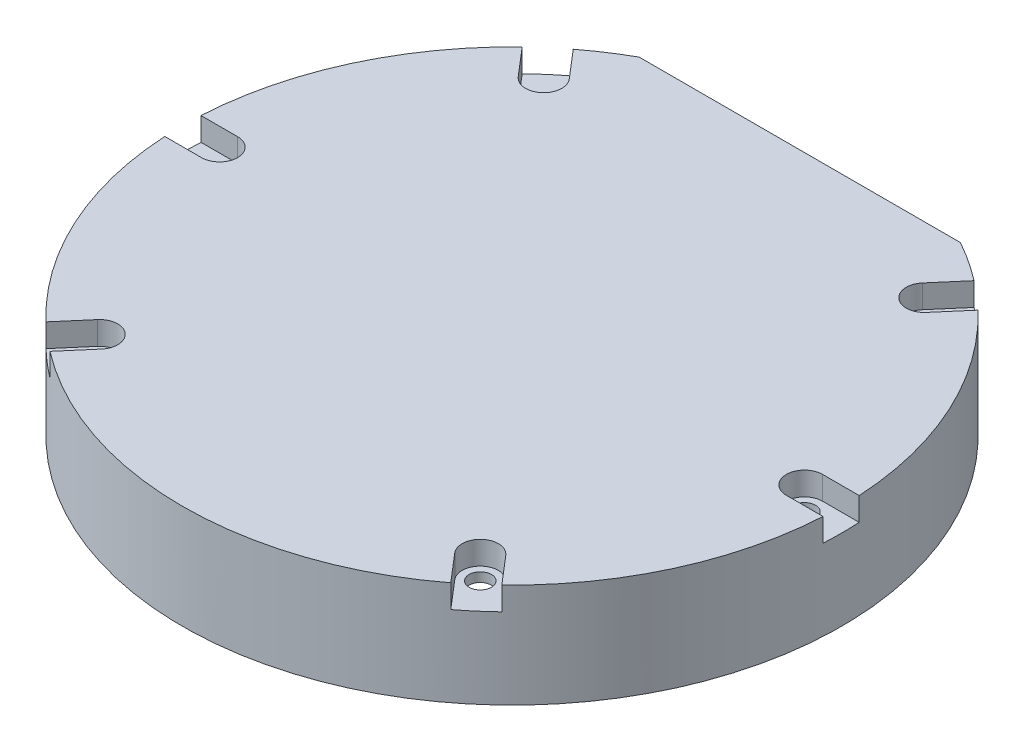
from build123d import *

# Parameters (mm, degrees)
SKETCH1_R            = 35.5
BOSS_EXTRUDE1_DEPTH  = 2
SKETCH2_R            = 35.5
SKETCH2_R_2          = 34
BOSS_EXTRUDE2_DEPTH  = 9.2
SKETCH5_R            = 34
SKETCH5_R_2          = 28.75
BOSS_EXTRUDE3_DEPTH  = 1.5
CUT_EXTRUDE2_REACH   = 53.439
CUT_EXTRUDE3_REACH   = 53.041
M2_CLEARANCE_HOLE1_D = 2.4
SKETCH10_R           = 1.2
CUT_EXTRUDE4_DEPTH   = 2.5


with BuildPart() as part:
    # Sketch1 → Boss-Extrude1 (new body)
    with BuildSketch(Plane.XZ):
        with Locations(Location((0, 0, 0), (0, 0, 270))):
            Circle(SKETCH1_R)
    extrude(amount=BOSS_EXTRUDE1_DEPTH)

    # Sketch2 → Boss-Extrude2 (add)
    with BuildSketch(Plane.XZ.offset(2)):
        with Locations(Location((0, 0, 0), (0, 0, 270))):
            Circle(SKETCH2_R)
        with Locations(Location((0, 0, 0), (0, 0, 270))):
            Circle(SKETCH2_R_2, mode=Mode.SUBTRACT)
    extrude(amount=BOSS_EXTRUDE2_DEPTH)

    # Sketch5 → Boss-Extrude3 (add)
    with BuildSketch(Plane.XZ.offset(2)):
        with Locations(Location((0, 0, 0), (0, 0, 270))):
            Circle(SKETCH5_R)
        with Locations(Location((0, 0, 0), (0, 0, 270))):
            Circle(SKETCH5_R_2, mode=Mode.SUBTRACT)
    extrude(amount=BOSS_EXTRUDE3_DEPTH)

    # Sketch3 → Cut-Extrude2 (cut, up to next)
    with BuildSketch(Plane(origin=(0, 0, 0), x_dir=(1, 0, 0), z_dir=(0, 1, 0)), mode=Mode.PRIVATE) as cut_extrude2_sk1:
        with BuildLine():
            Line((-17.298843892, 31), (17.298843892, 31))
            ThreePointArc((17.298843892, 31), (0, 35.5), (-17.298843892, 31))
        make_face()
    cut_extrude2_tool1 = extrude(cut_extrude2_sk1.sketch, amount=-CUT_EXTRUDE2_REACH, mode=Mode.PRIVATE) & part.part
    add(cut_extrude2_tool1.solids().sort_by_distance((0, 0, -32.810151))[0], mode=Mode.SUBTRACT)

    # Sketch6 → Cut-Extrude3 (cut, up to next)
    with BuildSketch(Plane.XZ.offset(2), mode=Mode.PRIVATE) as cut_extrude3_sk1:
        Polygon((-18.869547058, -31), (-16, -23.886450134), (16, -23.886450134), (18.869547058, -31), align=None)
    cut_extrude3_tool1 = extrude(cut_extrude3_sk1.sketch, amount=CUT_EXTRUDE3_REACH, mode=Mode.PRIVATE) & part.part
    add(cut_extrude3_tool1.solids().sort_by_distance((0, -2, -27.540792))[0], mode=Mode.SUBTRACT)

    # M2 Clearance Hole1 (through all)
    with Locations(Plane(origin=(0, 0, 0), x_dir=(1, 0, 0), z_dir=(0, 1, 0))):
        with Locations((-20.5, 23.916521486), (-31.5, 0), (-20.5, -23.916521486), (31.5, 0), (20.5, 23.916521486), (20.5, -23.916521486)):
            Hole(M2_CLEARANCE_HOLE1_D / 2)

    # Sketch10 → Cut-Extrude4 (cut)
    # profile 1 of 6: a face of its own
    with BuildSketch(Plane(origin=(0, 0, 0), x_dir=(1, 0, 0), z_dir=(0, 1, 0))):
        with BuildLine():
            Line((-35.446403203, 1.95), (-31.5, 1.95))
            ThreePointArc((-31.5, 1.95), (-29.55, 0), (-31.5, -1.95))
            Line((-31.5, -1.95), (-35.446403203, -1.95))
            ThreePointArc((-35.446403203, -1.95), (-35.5, 0), (-35.446403203, 1.95))
        make_face()
        with Locations(Location((-31.5, 0, 0), (0, 0, 270))):
            Circle(SKETCH10_R, mode=Mode.SUBTRACT)
    # profile 2 of 6: a face of its own
    with BuildSketch(Plane(origin=(0, 0, 0), x_dir=(1, 0, 0), z_dir=(0, 1, 0))):
        with BuildLine():
            Line((-24.548840716, 25.643798851), (-21.980546568, 22.647473867))
            ThreePointArc((-21.980546568, 22.647473867), (-19.230952381, 22.435974918), (-19.019453432, 25.185569105))
            Line((-19.019453432, 25.185569105), (-21.58774758, 28.181894089))
            ThreePointArc((-21.58774758, 28.181894089), (-23.103174603, 26.953540088), (-24.548840716, 25.643798851))
        make_face()
        with Locations(Location((-20.5, 23.916521486, 0), (0, 0, 270))):
            Circle(SKETCH10_R, mode=Mode.SUBTRACT)
    # profile 3 of 6: a face of its own
    with BuildSketch(Plane(origin=(0, 0, 0), x_dir=(1, 0, 0), z_dir=(0, 1, 0))):
        with BuildLine():
            Line((-21.58774758, -28.181894089), (-19.019453432, -25.185569105))
            ThreePointArc((-19.019453432, -25.185569105), (-19.230952381, -22.435974918), (-21.980546568, -22.647473867))
            Line((-21.980546568, -22.647473867), (-24.548840716, -25.643798851))
            ThreePointArc((-24.548840716, -25.643798851), (-23.103174603, -26.953540088), (-21.58774758, -28.181894089))
        make_face()
        with Locations(Location((-20.5, -23.916521486, 0), (0, 0, 270))):
            Circle(SKETCH10_R, mode=Mode.SUBTRACT)
    # profile 4 of 6: a face of its own
    with BuildSketch(Plane(origin=(0, 0, 0), x_dir=(1, 0, 0), z_dir=(0, 1, 0))):
        with BuildLine():
            Line((24.548840716, -25.643798851), (21.980546568, -22.647473867))
            ThreePointArc((21.980546568, -22.647473867), (19.230952381, -22.435974918), (19.019453432, -25.185569105))
            Line((19.019453432, -25.185569105), (21.58774758, -28.181894089))
            ThreePointArc((21.58774758, -28.181894089), (23.103174603, -26.953540088), (24.548840716, -25.643798851))
        make_face()
        with Locations(Location((20.5, -23.916521486, 0), (0, 0, 90))):
            Circle(SKETCH10_R, mode=Mode.SUBTRACT)
    # profile 5 of 6: a face of its own
    with BuildSketch(Plane(origin=(0, 0, 0), x_dir=(1, 0, 0), z_dir=(0, 1, 0))):
        with BuildLine():
            Line((21.58774758, 28.181894089), (19.019453432, 25.185569105))
            ThreePointArc((19.019453432, 25.185569105), (19.230952381, 22.435974918), (21.980546568, 22.647473867))
            Line((21.980546568, 22.647473867), (24.548840716, 25.643798851))
            ThreePointArc((24.548840716, 25.643798851), (23.103174603, 26.953540088), (21.58774758, 28.181894089))
        make_face()
        with Locations(Location((20.5, 23.916521486, 0), (0, 0, 90))):
            Circle(SKETCH10_R, mode=Mode.SUBTRACT)
    # profile 6 of 6: a face of its own
    with BuildSketch(Plane(origin=(0, 0, 0), x_dir=(1, 0, 0), z_dir=(0, 1, 0))):
        with BuildLine():
            Line((35.446403203, -1.95), (31.5, -1.95))
            ThreePointArc((31.5, -1.95), (29.55, 0), (31.5, 1.95))
            Line((31.5, 1.95), (35.446403203, 1.95))
            ThreePointArc((35.446403203, 1.95), (35.5, 0), (35.446403203, -1.95))
        make_face()
        with Locations(Location((31.5, 0, 0), (0, 0, 90))):
            Circle(SKETCH10_R, mode=Mode.SUBTRACT)
    extrude(amount=-CUT_EXTRUDE4_DEPTH, mode=Mode.SUBTRACT)


solid = part.part
